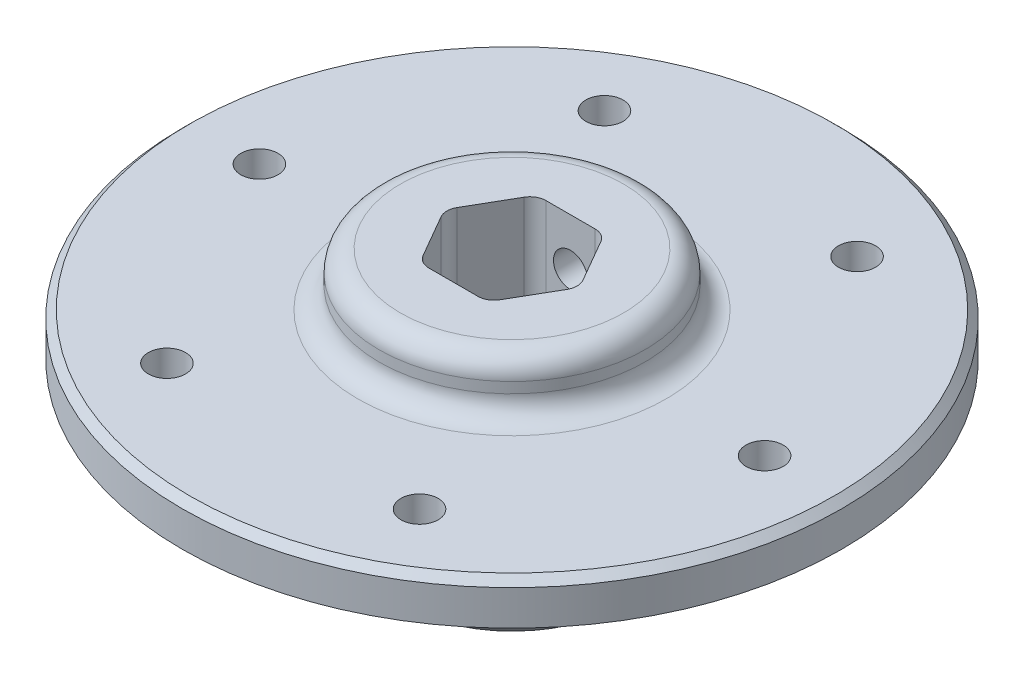
from build123d import *

# Parameters (mm, degrees)
SKETCH1_R           = 31
SKETCH1_R_2         = 1.75
BOSS_EXTRUDE1_DEPTH = 4
SKETCH2_R           = 12.5
BOSS_EXTRUDE2_DEPTH = 5
CUT_EXTRUDE1_DEPTH  = 45.754888001
FILLET1_R           = 2
FILLET2_R           = 2
SKETCH5_R           = 1.6
CUT_EXTRUDE2_DEPTH  = 10
CHAMFER2_SIZE       = 0.7
SKETCH6_R           = 11.5
BOSS_EXTRUDE3_DEPTH = 15
FILLET3_R           = 2
CUT_EXTRUDE3_DEPTH  = 50.979995998
FILLET4_R           = 1.5


with BuildPart() as part:
    # Sketch1 → Boss-Extrude1 (new body)
    with BuildSketch(Plane(origin=(0, 0, 0), x_dir=(1, 0, 0), z_dir=(0, 1, 0))):
        with Locations(Location((0, 0, 0), (0, 0, 270))):
            Circle(SKETCH1_R)
        with Locations(Location((-11.875, 20.56810334, 0), (0, 0, 270))):
            Circle(SKETCH1_R_2, mode=Mode.SUBTRACT)
        with Locations(Location((11.875, 20.56810334, 0), (0, 0, 270))):
            Circle(SKETCH1_R_2, mode=Mode.SUBTRACT)
        with Locations(Location((23.75, 0, 0), (0, 0, 270))):
            Circle(SKETCH1_R_2, mode=Mode.SUBTRACT)
        with Locations(Location((11.875, -20.56810334, 0), (0, 0, 270))):
            Circle(SKETCH1_R_2, mode=Mode.SUBTRACT)
        with Locations(Location((-11.875, -20.56810334, 0), (0, 0, 270))):
            Circle(SKETCH1_R_2, mode=Mode.SUBTRACT)
        with Locations(Location((-23.75, 0, 0), (0, 0, 270))):
            Circle(SKETCH1_R_2, mode=Mode.SUBTRACT)
    extrude(amount=BOSS_EXTRUDE1_DEPTH)

    # Sketch2 → Boss-Extrude2 (add)
    with BuildSketch(Plane(origin=(0, 4, 0), x_dir=(1, 0, 0), z_dir=(0, 1, 0))):
        with Locations(Location((0, 0, 0), (0, 0, 270))):
            Circle(SKETCH2_R)
    extrude(amount=BOSS_EXTRUDE2_DEPTH)

    # Sketch3 → Cut-Extrude1 (cut, through all)
    with BuildSketch(Plane(origin=(0, 9, 0), x_dir=(1, 0, 0), z_dir=(0, 1, 0))):
        Polygon((3.175426481, 5.5), (-3.175426481, 5.5), (-6.350852961, 0), (-3.175426481, -5.5), (3.175426481, -5.5), (6.350852961, 0), align=None)
    extrude(amount=-CUT_EXTRUDE1_DEPTH, mode=Mode.SUBTRACT)

    # Fillet1
    fillet1_edges = [part.edges().sort_by_distance(p)[0] for p in [
        (3.175426481, 4.5, -5.5),
        (6.350852961, 4.5, 0),
        (3.175426481, 4.5, 5.5),
        (-3.175426481, 4.5, 5.5),
        (-6.350852961, 4.5, 0),
        (-3.175426481, 4.5, -5.5),
    ]]
    fillet(fillet1_edges, radius=FILLET1_R)

    # Fillet2
    fillet2_edges = [part.edges().sort_by_distance(p)[0] for p in [
        (0, 4, -12.5),
        (0, 9, -12.5),
    ]]
    fillet(fillet2_edges, radius=FILLET2_R)

    # Sketch5 → Cut-Extrude2 (cut)
    with BuildSketch(Plane(origin=(0, 9, -12.5), x_dir=(-1, 0, 0), z_dir=(0, 0, -1))):
        with Locations((0, -4.5)):
            Circle(SKETCH5_R)
    extrude(amount=-CUT_EXTRUDE2_DEPTH, mode=Mode.SUBTRACT)

    # Chamfer2
    chamfer2_edges = [part.edges().sort_by_distance(p)[0] for p in [
        (0, 4, -31),
    ]]
    chamfer(chamfer2_edges, length=CHAMFER2_SIZE)

    # Sketch6 → Boss-Extrude3 (add)
    with BuildSketch(Plane(origin=(0, 0, 0), x_dir=(-1, 0, 0), z_dir=(0, -1, 0))):
        with Locations(Location((0, 0, 0), (0, 0, 270))):
            Circle(SKETCH6_R)
    extrude(amount=BOSS_EXTRUDE3_DEPTH)

    # Fillet3
    fillet3_edges = [part.edges().sort_by_distance(p)[0] for p in [
        (0, -15, -11.5),
    ]]
    fillet(fillet3_edges, radius=FILLET3_R)

    # Sketch7 → Cut-Extrude3 (cut, through all)
    with BuildSketch(Plane(origin=(0, -15, 0), x_dir=(-1, 0, 0), z_dir=(0, -1, 0))):
        Polygon((-3.175426481, -5.5), (3.175426481, -5.5), (6.350852961, 0), (3.175426481, 5.5), (-3.175426481, 5.5), (-6.350852961, 0), align=None)
    extrude(amount=-CUT_EXTRUDE3_DEPTH, mode=Mode.SUBTRACT)

    # Fillet4
    fillet4_edges = [part.edges().sort_by_distance(p)[0] for p in [
        (3.175426481, -3, 5.5),
        (3.175426481, -3, -5.5),
        (6.350852961, -3, 0),
        (-3.175426481, -3, -5.5),
        (-6.350852961, -3, 0),
        (-3.175426481, -3, 5.5),
    ]]
    fillet(fillet4_edges, radius=FILLET4_R)


solid = part.part
